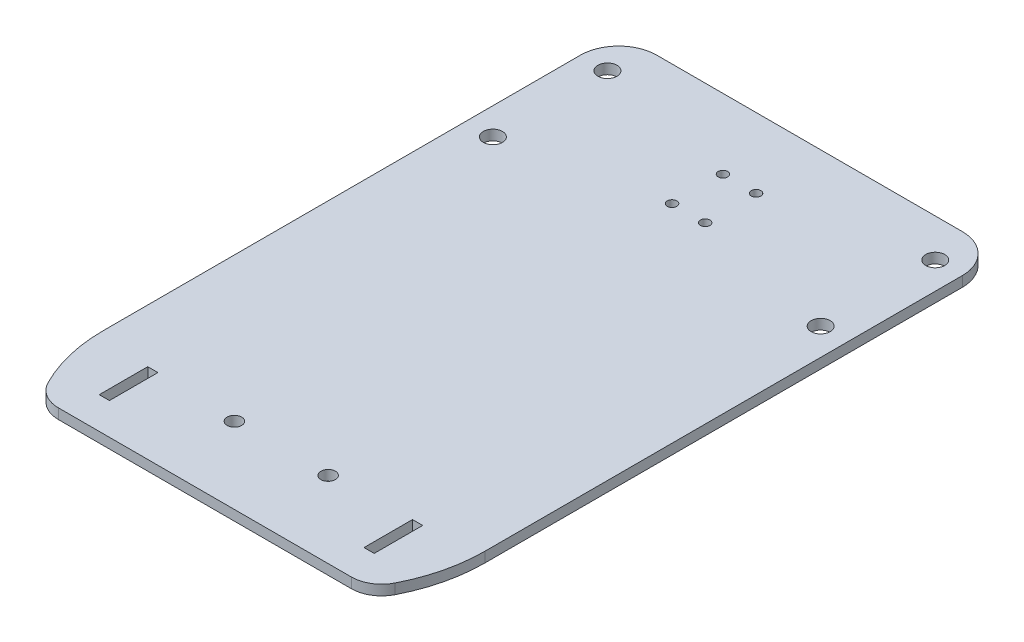
from build123d import *

# Parameters (mm, degrees)
SKICA1_W                 = 60
SKICA1_H                 = 95
P_IDAT_VYSUNUT_M1_DEPTH  = 0.8
SKICA3_OUTSIDE_W         = 84.474
SKICA3_OUTSIDE_H         = 119.474
ODEBRAT_VYSUNUT_M2_DEPTH = 100.637141669
SKICA2_W                 = 1.6
SKICA2_H                 = 7.62
ODEBRAT_VYSUNUT_M1_DEPTH = 100.637141669
SKICA4_R                 = 1.5
ODEBRAT_VYSUNUT_M3_DEPTH = 100.637141669
SKICA5_R                 = 1.143
ODEBRAT_VYSUNUT_M4_DEPTH = 100.637141669
SKICA8_R                 = 0.75
ODEBRAT_VYSUNUT_M5_DEPTH = 100.637141669


with BuildPart() as part:
    # Skica1 → Přidat vysunutím1 (new, symmetric)
    with BuildSketch(Plane(origin=(0, 0, 0), x_dir=(1, 0, 0), z_dir=(0, 1, 0))):
        with Locations((0, -47.5)):
            Rectangle(SKICA1_W, SKICA1_H)
    extrude(amount=P_IDAT_VYSUNUT_M1_DEPTH, both=True)

    # Skica3 outside → Odebrat vysunutím2 (cut, through all)
    with BuildSketch(Plane(origin=(0, 0.8, 0), x_dir=(1, 0, 0), z_dir=(0, 1, 0))):
        with Locations((0, -47.5)):
            Rectangle(SKICA3_OUTSIDE_W, SKICA3_OUTSIDE_H)
        with BuildLine():
            Line((-24, 0), (24, 0))
            ThreePointArc((24, 0), (28.242640687, -1.757359313), (30, -6))
            Line((30, -6), (30, -81))
            ThreePointArc((30, -81), (29.302055214, -86.866013328), (27.247191011, -92.404494382))
            ThreePointArc((27.247191011, -92.404494382), (25.488738681, -94.299754206), (23, -95))
            Line((23, -95), (-23, -95))
            ThreePointArc((-23, -95), (-25.488738681, -94.299754206), (-27.247191011, -92.404494382))
            ThreePointArc((-27.247191011, -92.404494382), (-29.302055214, -86.866013328), (-30, -81))
            Line((-30, -81), (-30, -6))
            ThreePointArc((-30, -6), (-28.242640687, -1.757359313), (-24, 0))
        make_face(mode=Mode.SUBTRACT)
    extrude(amount=-ODEBRAT_VYSUNUT_M2_DEPTH, mode=Mode.SUBTRACT)

    # Skica2 → Odebrat vysunutím1 (cut, through all)
    with BuildSketch(Plane(origin=(0, 0.8, 0), x_dir=(1, 0, 0), z_dir=(0, 1, 0))):
        with Locations((-20.8, -86.19)):
            Rectangle(SKICA2_W, SKICA2_H)
        with Locations((20.8, -86.19)):
            Rectangle(SKICA2_W, SKICA2_H)
    extrude(amount=-ODEBRAT_VYSUNUT_M1_DEPTH, mode=Mode.SUBTRACT)

    # Skica4 → Odebrat vysunutím3 (cut, through all)
    with BuildSketch(Plane(origin=(0, 0.8, 0), x_dir=(1, 0, 0), z_dir=(0, 1, 0))):
        with Locations(Location((-25.75, -6, 0), (0, 0, 270))):
            Circle(SKICA4_R)
        with Locations(Location((-25.75, -24, 0), (0, 0, 270))):
            Circle(SKICA4_R)
        with Locations(Location((25.75, -24, 0), (0, 0, 90))):
            Circle(SKICA4_R)
        with Locations(Location((25.75, -6, 0), (0, 0, 90))):
            Circle(SKICA4_R)
    extrude(amount=-ODEBRAT_VYSUNUT_M3_DEPTH, mode=Mode.SUBTRACT)

    # Skica5 → Odebrat vysunutím4 (cut, through all)
    with BuildSketch(Plane.XZ.offset(0.8)):
        with Locations(Location((-7.366, 83, 0), (0, 0, 270))):
            Circle(SKICA5_R)
        with Locations(Location((7.366, 83, 0), (0, 0, 270))):
            Circle(SKICA5_R)
    extrude(amount=-ODEBRAT_VYSUNUT_M4_DEPTH, mode=Mode.SUBTRACT)

    # Skica8 → Odebrat vysunutím5 (cut, through all)
    with BuildSketch(Plane(origin=(0, 0.8, 0), x_dir=(1, 0, 0), z_dir=(0, 1, 0))):
        with Locations(Location((-2.6, -11, 0), (0, 0, 270))):
            Circle(SKICA8_R)
        with Locations(Location((-2.6, -19, 0), (0, 0, 270))):
            Circle(SKICA8_R)
        with Locations(Location((2.6, -19, 0), (0, 0, 90))):
            Circle(SKICA8_R)
        with Locations(Location((2.6, -11, 0), (0, 0, 90))):
            Circle(SKICA8_R)
    extrude(amount=-ODEBRAT_VYSUNUT_M5_DEPTH, mode=Mode.SUBTRACT)


solid = part.part
